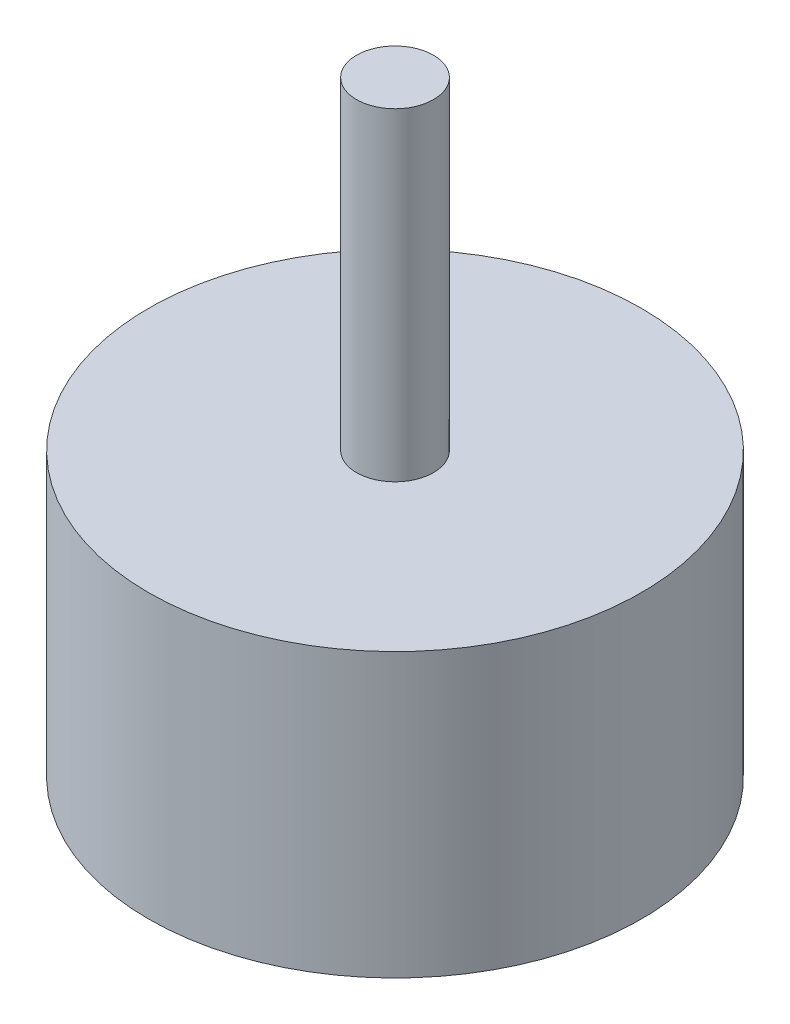
from build123d import *


with BuildPart() as part:
    # Esboço1 → Revolução1 (revolve)
    with BuildSketch(Plane.XY, mode=Mode.PRIVATE) as revolu_o1_sk:
        Polygon((0, 0), (0, 75), (-4.7625, 75), (-4.7625, 35), (-30.5, 35), (-30.5, 0), align=None)
    revolve(revolu_o1_sk.sketch.rotate(Axis((0, 0, 0), (0, 1, 0)), 270), axis=Axis((0, 0, 0), (0, 1, 0)))


solid = part.part
